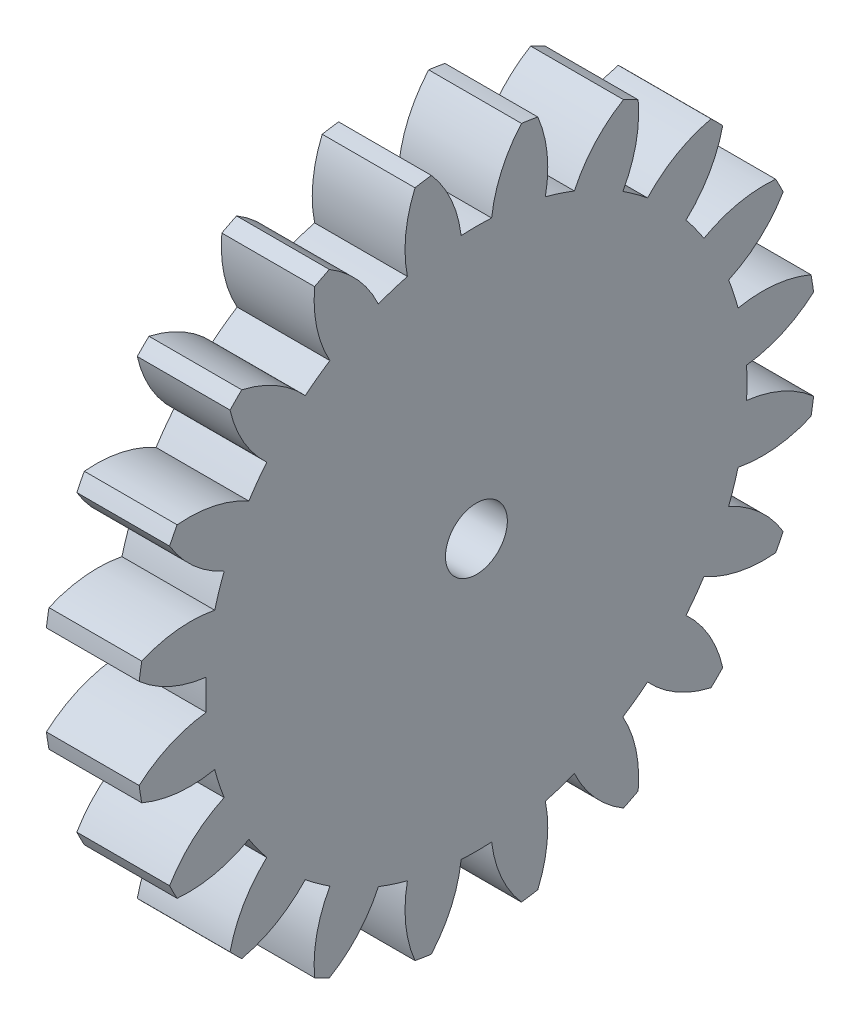
from build123d import *

# Parameters (mm, degrees)
BASPROSKE_W     = 6
BASPROSKE_H     = 22
TOOTHCUT_DEPTH  = 32.685959036
TEETHCUTS_COUNT = 20
TEETHCUTS_ANGLE = 342
BORSKE_R        = 2
BORE_DEPTH      = 50.0000508


with BuildPart() as part:
    # BasProSke → Base-Revolve (revolve)
    with BuildSketch(Plane(origin=(0, 0, 0), x_dir=(1, 0, 0), z_dir=(0, 1, 0)), mode=Mode.PRIVATE) as base_revolve_sk:
        with Locations((3, 11)):
            Rectangle(BASPROSKE_W, BASPROSKE_H)
    revolve(base_revolve_sk.sketch.rotate(Axis((-10, 0, 0), (1, 0, 0)), 180), axis=Axis((-10, 0, 0), (1, 0, 0)))

    # TooCutSke → ToothCut (cut, through all)
    with BuildSketch(Plane(origin=(0, 0, 0), x_dir=(0, 0, -1), z_dir=(1, 0, 0))):
        with BuildLine():
            ThreePointArc((0.986171591, 17.471189616), (0, 17.499), (-0.986171591, 17.471189616))
            ThreePointArc((-0.986171591, 17.471189616), (-1.626916196, 19.798789858), (-2.932850173, 21.829260982))
            ThreePointArc((-2.932850173, 21.829260982), (0, 22.0254), (2.932850173, 21.829260982))
            ThreePointArc((2.932850173, 21.829260982), (1.626916196, 19.798789858), (0.986171591, 17.471189616))
        make_face()
    toothcut = extrude(amount=TOOTHCUT_DEPTH, mode=Mode.SUBTRACT)

    # TeethCuts: ToothCut ×20 about axis
    teethcuts_axis = Axis((-10, 0, 0), (1, 0, 0))
    for i in range(1, TEETHCUTS_COUNT):
        add(toothcut.rotate(teethcuts_axis, i * TEETHCUTS_ANGLE / (TEETHCUTS_COUNT - 1)), mode=Mode.SUBTRACT)

    # BorSke → Bore (cut, symmetric)
    with BuildSketch(Plane(origin=(0, 0, 0), x_dir=(0, 0, -1), z_dir=(1, 0, 0))):
        with Locations(Location((0, 0, 0), (0, 0, 180))):
            Circle(BORSKE_R)
    extrude(amount=BORE_DEPTH, both=True, mode=Mode.SUBTRACT)


solid = part.part
